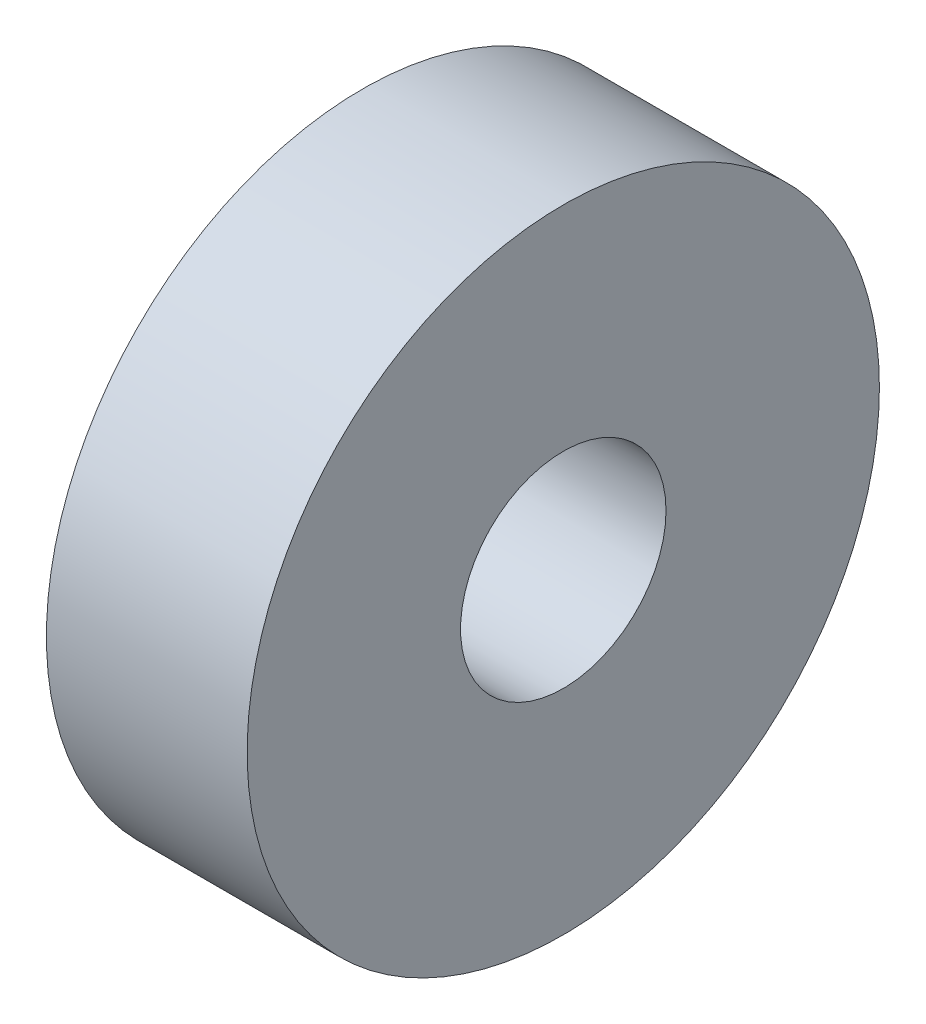
from build123d import *

# Parameters (mm, degrees)
SKETCH1_R           = 10
SKETCH1_R_2         = 3.25
BOSS_EXTRUDE1_DEPTH = 6.35


with BuildPart() as part:
    # Sketch1 → Boss-Extrude1 (new body)
    with BuildSketch(Plane(origin=(0, 0, 0), x_dir=(0, 0, -1), z_dir=(1, 0, 0))):
        Circle(SKETCH1_R)
        Circle(SKETCH1_R_2, mode=Mode.SUBTRACT)
    extrude(amount=BOSS_EXTRUDE1_DEPTH)


solid = part.part
